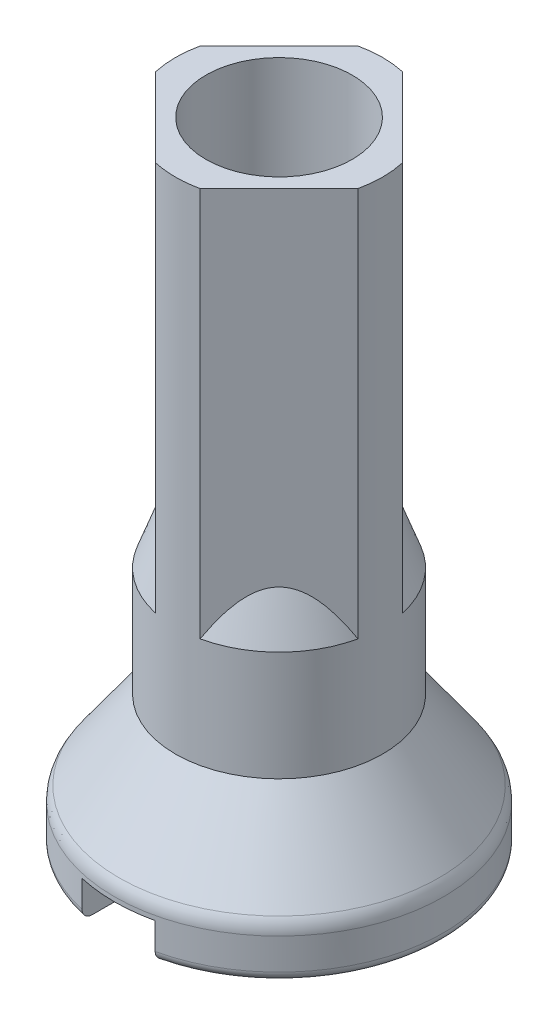
from build123d import *

# Parameters (mm, degrees)
SKETCH2_OUTSIDE_W  = 11.976
SKETCH2_OUTSIDE_H  = 11.976
CUT_EXTRUDE1_DEPTH = 8
SKETCH4_R          = 1.5
CUT_EXTRUDE2_DEPTH = 8
SKETCH5_W          = 1.5
SKETCH5_H          = 6.75
CUT_EXTRUDE3_DEPTH = 0.75


with BuildPart() as part:
    # Sketch1 → Revolve1 (revolve)
    with BuildSketch(Plane.XY, mode=Mode.PRIVATE) as revolve1_sk:
        with BuildLine():
            Line((1, 0), (3.175, 0))
            ThreePointArc((3.175, 0), (3.316421356, 0.058578644), (3.375, 0.2))
            Line((3.375, 0.2), (3.375, 0.839767473))
            ThreePointArc((3.375, 0.839767473), (3.351147754, 0.992356189), (3.281866736, 1.13038657))
            Line((3.281866736, 1.13038657), (2.125, 2.75))
            Line((2.125, 2.75), (2.125, 9.05))
            Line((2.125, 9.05), (2.125, 13))
            Line((2.125, 13), (1, 13))
            Line((1, 13), (1, 0))
        make_face()
    revolve(revolve1_sk.sketch.rotate(Axis((0, 13, 0), (0, -1, 0)), 90), axis=Axis((0, 13, 0), (0, -1, 0)))

    # Sketch2 outside → Cut-Extrude1 (cut)
    with BuildSketch(Plane(origin=(0, 13, 0), x_dir=(1, 0, 0), z_dir=(0, 1, 0))):
        Rectangle(SKETCH2_OUTSIDE_W, SKETCH2_OUTSIDE_H)
        Polygon((0, 2.531442277), (-2.531442277, 0), (0, -2.531442277), (2.531442277, 0), align=None, mode=Mode.SUBTRACT)
    extrude(amount=-CUT_EXTRUDE1_DEPTH, mode=Mode.SUBTRACT)

    # Boss-Extrude1 cone 1 section (through the dimple's axis) → Boss-Extrude1 (revolve)
    with BuildSketch(Plane(origin=(0, 5, 0), x_dir=(0, 0, -1), z_dir=(1, 0, 0))):
        Polygon((0, 0), (2.125, 0), (0, 5.838389516), align=None)
    revolve(axis=Axis((0, 5, 0), (0, 1, 0)))

    # Sketch4 → Cut-Extrude2 (cut)
    with BuildSketch(Plane(origin=(0, 13, 0), x_dir=(1, 0, 0), z_dir=(0, 1, 0))):
        with Locations(Location((0, 0, 0), (0, 0, 270))):
            Circle(SKETCH4_R)
    extrude(amount=-CUT_EXTRUDE2_DEPTH, mode=Mode.SUBTRACT)

    # Sketch5 → Cut-Extrude3 (cut)
    with BuildSketch(Plane.XZ):
        Rectangle(SKETCH5_W, SKETCH5_H)
    extrude(amount=-CUT_EXTRUDE3_DEPTH, mode=Mode.SUBTRACT)


solid = part.part
